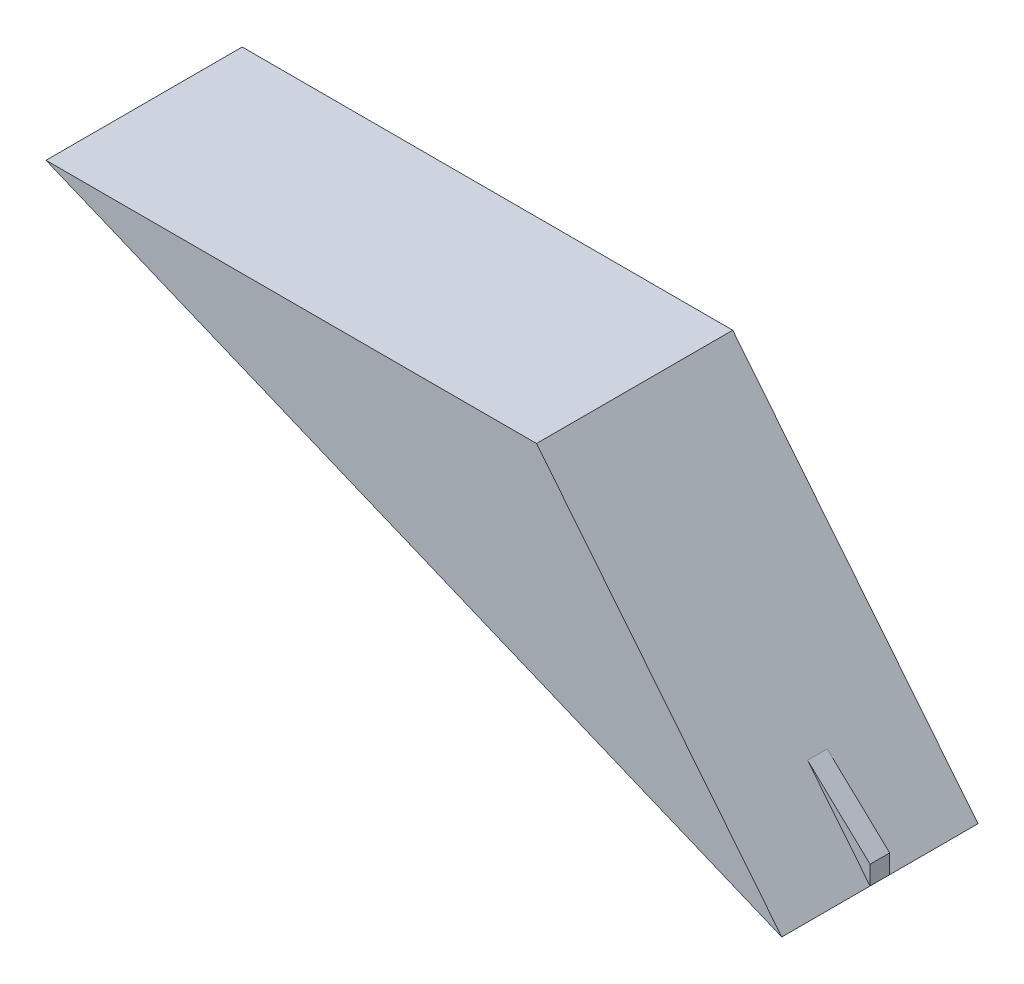
from build123d import *

# Parameters (mm, degrees)
BOSS_EXTRUDE1_DEPTH = 100
BOSS_EXTRUDE2_DEPTH = 10


with BuildPart() as part:
    # Sketch1 → Boss-Extrude1 (new, symmetric)
    with BuildSketch(Plane.XY):
        Polygon((0, 0), (500, 0), (750, -310.66017178), align=None)
    extrude(amount=BOSS_EXTRUDE1_DEPTH, both=True)

    # Sketch2 → Boss-Extrude2 (add, symmetric)
    with BuildSketch(Plane.XY):
        Polygon((686.273799006, -284.263915049), (686.273799006, -231.471401589), (750, -291.408761965), (750, -310.66017178), align=None)
    extrude(amount=BOSS_EXTRUDE2_DEPTH, both=True)


solid = part.part
